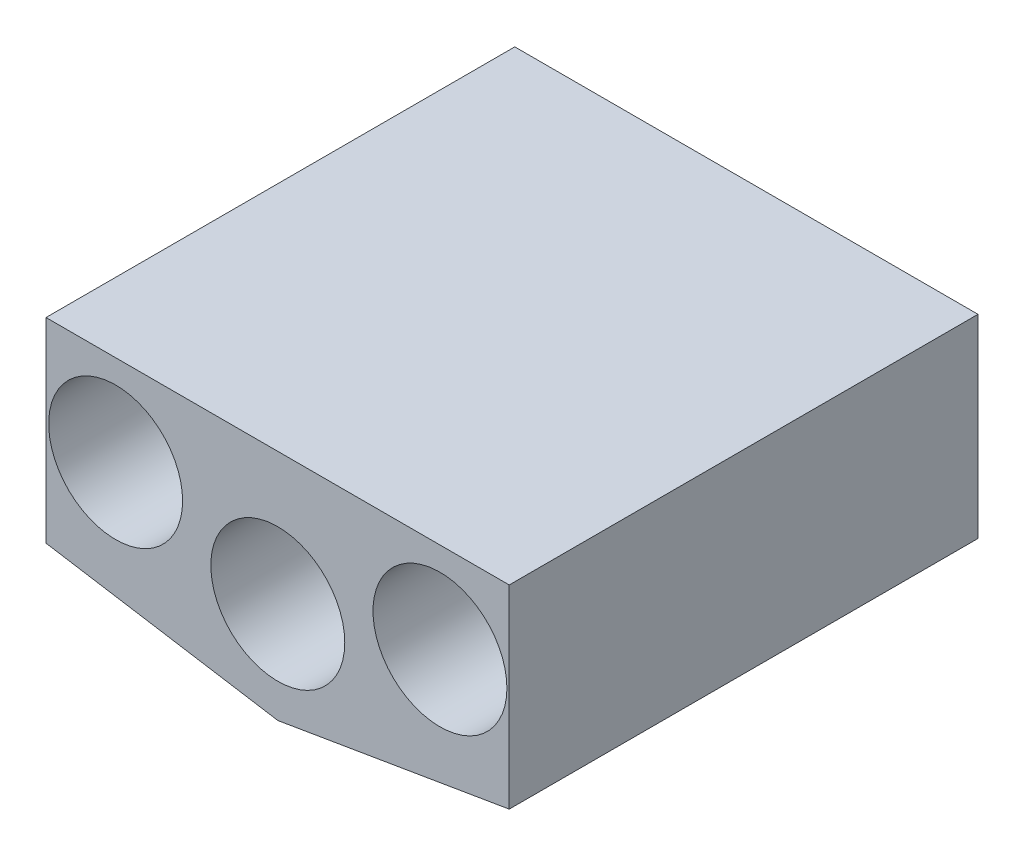
from build123d import *

# Parameters (mm, degrees)
IZIM1_R                     = 10
Y_KSEKLIK_EKSTR_ZYON2_DEPTH = 70
IZIM4_R                     = 2.9
KES_EKSTR_ZYON1_DEPTH       = 10
IZIM6_R                     = 2.9
KES_EKSTR_ZYON2_DEPTH       = 10


with BuildPart() as part:
    # Çizim1 → Yükseklik-Ekstrüzyon2 (new body)
    with BuildSketch(Plane.XY):
        Polygon((34.558000078, -9.253153646), (0.014602542, -15.067885605), (-34.611999922, -9.444150005), (-34.611999922, 19.740712429), (34.558000078, 19.740712429), align=None)
        with Locations((-24.214579028, 6.217247179)):
            Circle(IZIM1_R, mode=Mode.SUBTRACT)
        Circle(IZIM1_R, mode=Mode.SUBTRACT)
        with Locations((24.214579028, 6.217247179)):
            Circle(IZIM1_R, mode=Mode.SUBTRACT)
    extrude(amount=Y_KSEKLIK_EKSTR_ZYON2_DEPTH)

    # Çizim4 → Kes-Ekstrüzyon1 (cut, along a direction that is not the sketch's normal)
    with BuildSketch(Plane(origin=(-2.383921421, -14.678339313, 0), x_dir=(0.9870666640552537, -0.1603103262763605, 0), z_dir=(-0.1603103262763605, -0.9870666640552537, 0))):
        with Locations((-10.65035653, 60)):
            Circle(IZIM4_R)
        with Locations((-10.65035653, 10)):
            Circle(IZIM4_R)
    extrude(amount=-KES_EKSTR_ZYON1_DEPTH, dir=(0, -1, 0), mode=Mode.SUBTRACT)

    # Çizim6 → Kes-Ekstrüzyon2 (cut, along a direction that is not the sketch's normal)
    with BuildSketch(Plane(origin=(2.466908381, -14.655085992, 0), x_dir=(0.9861264495259806, 0.16599586002453082, 0), z_dir=(0.16599586002453082, -0.9861264495259807, 0))):
        with Locations((10.542572723, 60)):
            Circle(IZIM6_R)
        with Locations((10.542572723, 10)):
            Circle(IZIM6_R)
    extrude(amount=-KES_EKSTR_ZYON2_DEPTH, dir=(0, -1, 0), mode=Mode.SUBTRACT)


solid = part.part
